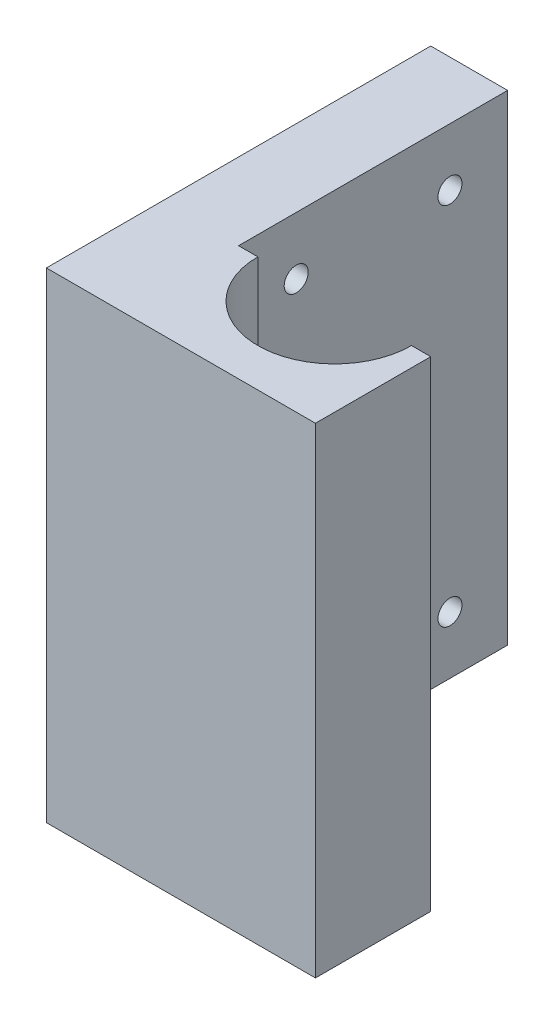
from build123d import *

# Parameters (mm, degrees)
EXTRUDE_1_DEPTH    = 50
HOLE_WIZARD_M3_1_D = 2.5


with BuildPart() as part:
    # 草图1 → 凸台-拉伸1 (new body)
    with BuildSketch(Plane(origin=(0, 0, 0), x_dir=(1, 0, 0), z_dir=(0, 1, 0))):
        with BuildLine():
            Line((0, 0), (0, 28))
            Line((0, 28), (-8, 28))
            Line((-8, 28), (-8, -12))
            Line((-8, -12), (20, -12))
            Line((20, -12), (20, 0))
            Line((20, 0), (18, 0))
            ThreePointArc((18, 0), (10, -8), (2, 0))
            Line((2, 0), (0, 0))
        make_face()
    extrude(amount=EXTRUDE_1_DEPTH)

    # M3 螺纹孔1 (through all)
    with Locations(Plane(origin=(0, 0, 0), x_dir=(0, 0, -1), z_dir=(1, 0, 0))):
        with Locations((22, 44), (6, 44), (6, 6), (22, 6)):
            Hole(HOLE_WIZARD_M3_1_D / 2)


solid = part.part
